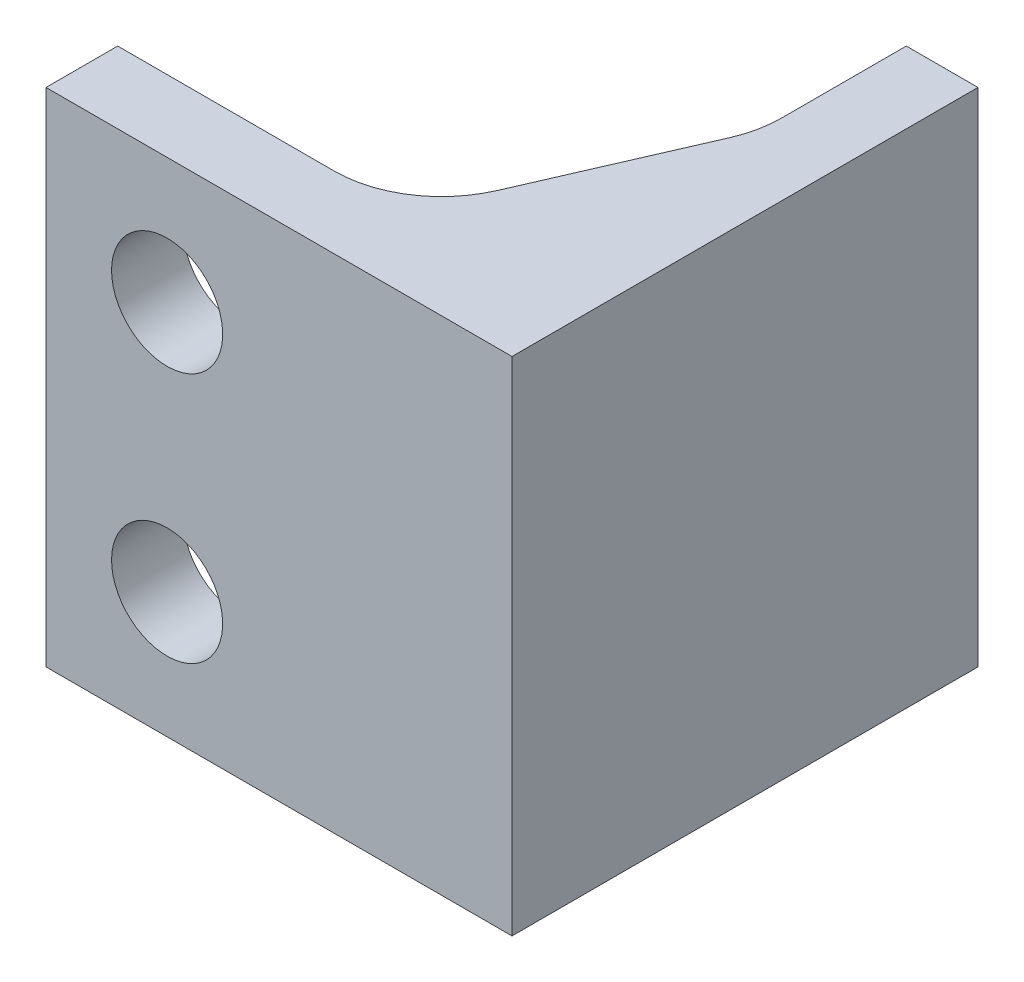
from build123d import *

# Parameters (mm, degrees)
BOSS_EXTRUDE1_DEPTH = 7
CUT_EXTRUDE1_REACH  = 20.412
SKETCH3_R           = 1.55


with BuildPart() as part:
    # Sketch1 → Boss-Extrude1 (new body)
    with BuildSketch(Plane(origin=(0, 0, 0), x_dir=(1, 0, 0), z_dir=(0, 1, 0))):
        with BuildLine():
            Line((0, 0), (-13, 0))
            Line((-13, 0), (-13, 2))
            Line((-13, 2), (-6.966770758, 2))
            ThreePointArc((-6.966770758, 2), (-5.321958583, 2.49109727), (-4.215654921, 3.803604727))
            Line((-4.215654921, 3.803604727), (-2.248884163, 8.326202151))
            ThreePointArc((-2.248884163, 8.326202151), (-2.062880024, 8.911593133), (-2, 9.522597424))
            Line((-2, 9.522597424), (-2, 13))
            Line((-2, 13), (0, 13))
            Line((0, 13), (0, 0))
        make_face()
    extrude(amount=BOSS_EXTRUDE1_DEPTH)

    # Sketch3 → Cut-Extrude1 (cut, up to next)
    with BuildSketch(Plane(origin=(0, 0, -2), x_dir=(-1, 0, 0), z_dir=(0, 0, -1)), mode=Mode.PRIVATE) as cut_extrude1_sk1:
        with Locations((9.621320344, 3.5)):
            Circle(SKETCH3_R)
    cut_extrude1_tool1 = extrude(cut_extrude1_sk1.sketch, amount=-CUT_EXTRUDE1_REACH, mode=Mode.PRIVATE) & part.part
    add(cut_extrude1_tool1.solids().sort_by_distance((-9.62132, 3.5, -2))[0], mode=Mode.SUBTRACT)

    # Mirror1: part across plane


with BuildPart() as part_1:
    add(part.part)
    add(part.part.mirror(Plane(origin=(-6.966770758, 7, -5), x_dir=(0, 0, 1), z_dir=(0, -1, 0))))


solid = part_1.part
